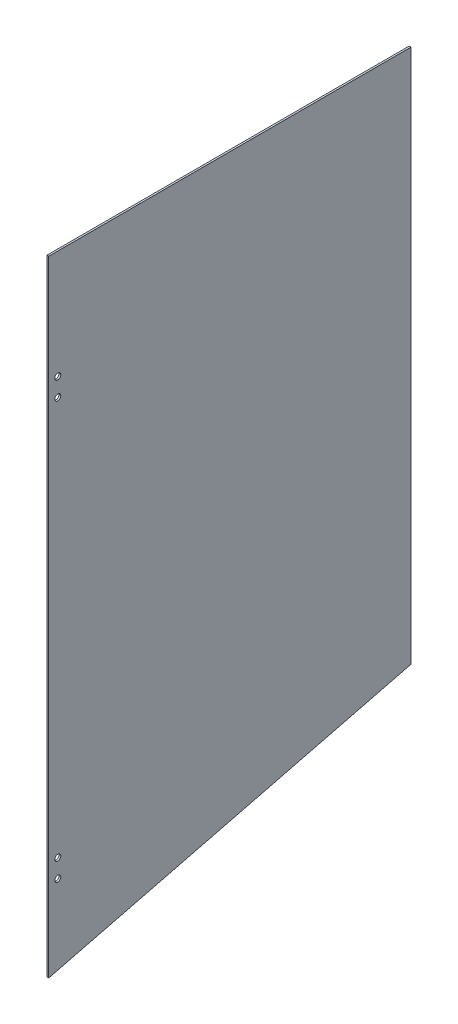
from build123d import *

# Parameters (mm, degrees)
BOSS_EXTRUDE1_DEPTH   = 1
M4X0_7_TAPPED_HOLE1_D = 3.3


with BuildPart() as part:
    # Sketch1 → Boss-Extrude1 (new body)
    with BuildSketch(Plane(origin=(0, 0, 0), x_dir=(0, 0, -1), z_dir=(1, 0, 0))):
        Polygon((-100, 172.5), (-100, -172.5), (100, -122.5), (100, 172.5), align=None)
    extrude(amount=BOSS_EXTRUDE1_DEPTH)

    # M4x0.7 Tapped Hole1 (through all)
    with Locations(Plane(origin=(1, 0, 0), x_dir=(0, 0, -1), z_dir=(1, 0, 0))):
        with Locations((-95, 112.5), (-95, 102.5), (-95, -117.5), (-95, -127.5)):
            Hole(M4X0_7_TAPPED_HOLE1_D / 2)


solid = part.part
